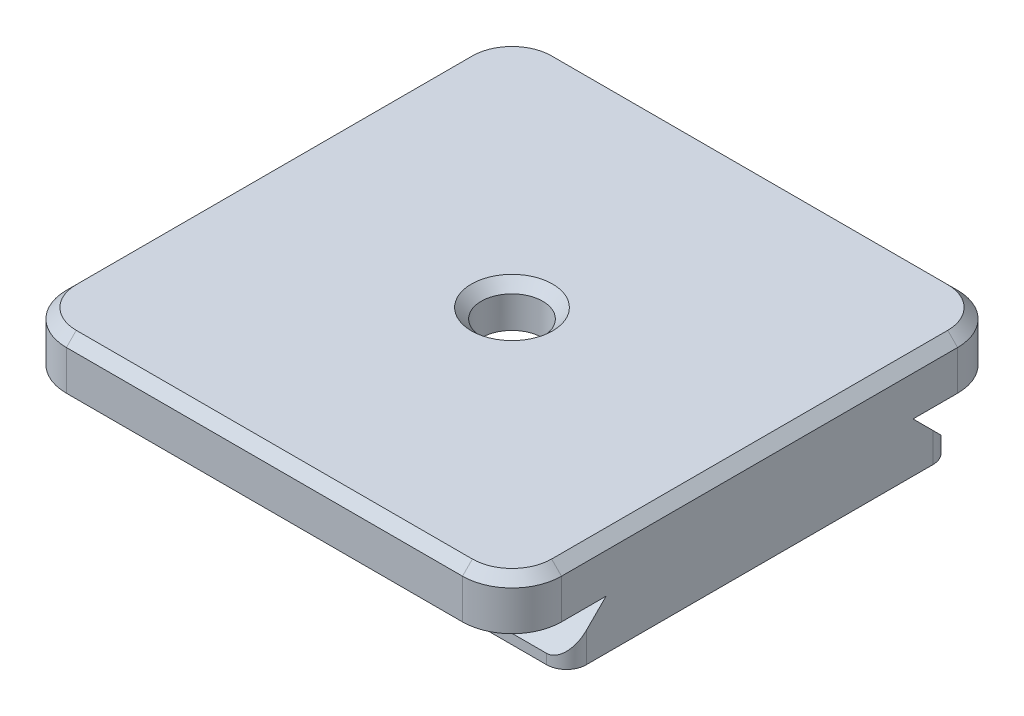
from build123d import *

# Parameters (mm, degrees)
SKETCH1_W           = 50
SKETCH1_H           = 50
BOSS_EXTRUDE1_DEPTH = 10
CUT_EXTRUDE3_DEPTH  = 6.3
SKETCH5_R           = 6.5
SKETCH5_R_2         = 3.1
BOSS_EXTRUDE2_DEPTH = 0.5
SKETCH6_R           = 2.7
BOSS_EXTRUDE3_DEPTH = 2.5
FILLET1_R           = 0.5
CUT_EXTRUDE4_DEPTH  = 57.789083458
FILLET2_R           = 5
CHAMFER1_SIZE       = 1
CHAMFER2_SIZE       = 1
CHAMFER2_SIZE2      = 1.414213562
FILLET3_R           = 2
SKETCH9_R           = 3.1
CUT_EXTRUDE5_DEPTH  = 37.434050008
CHAMFER3_SIZE       = 1


with BuildPart() as part:
    # Sketch1 → Boss-Extrude1 (new body)
    with BuildSketch(Plane(origin=(0, 0, 0), x_dir=(1, 0, 0), z_dir=(0, 1, 0))):
        Rectangle(SKETCH1_W, SKETCH1_H)
    extrude(amount=BOSS_EXTRUDE1_DEPTH)

    # Sketch4 → Cut-Extrude3 (cut)
    with BuildSketch(Plane(origin=(0, 0, 0), x_dir=(-1, 0, 0), z_dir=(0, -1, 0))):
        with BuildLine():
            Line((21, -7.228416147), (21, -10.5))
            ThreePointArc((21, -10.5), (20.267766953, -12.267766953), (18.5, -13))
            Line((18.5, -13), (-18.5, -13))
            ThreePointArc((-18.5, -13), (-20.267766953, -12.267766953), (-21, -10.5))
            Line((-21, -10.5), (-21, -7.228416147))
            ThreePointArc((-21, -7.228416147), (-20.591644852, -6.017356006), (-19.533333333, -5.300838508))
            ThreePointArc((-19.533333333, -5.300838508), (-15.5, 0), (-19.533333333, 5.300838508))
            ThreePointArc((-19.533333333, 5.300838508), (-20.591644852, 6.017356006), (-21, 7.228416147))
            Line((-21, 7.228416147), (-21, 10.5))
            ThreePointArc((-21, 10.5), (-20.267766953, 12.267766953), (-18.5, 13))
            Line((-18.5, 13), (18.5, 13))
            ThreePointArc((18.5, 13), (20.267766953, 12.267766953), (21, 10.5))
            Line((21, 10.5), (21, 7.228416147))
            ThreePointArc((21, 7.228416147), (20.591644852, 6.017356006), (19.533333333, 5.300838508))
            ThreePointArc((19.533333333, 5.300838508), (15.5, 0), (19.533333333, -5.300838508))
            ThreePointArc((19.533333333, -5.300838508), (20.591644852, -6.017356006), (21, -7.228416147))
        make_face()
    extrude(amount=-CUT_EXTRUDE3_DEPTH, mode=Mode.SUBTRACT)

    # Sketch5 → Boss-Extrude2 (add)
    with BuildSketch(Plane(origin=(0, 6.3, 0), x_dir=(-1, 0, 0), z_dir=(0, -1, 0))):
        with Locations(Location((0, 0, 0), (0, 0, 90))):
            Circle(SKETCH5_R)
        with Locations(Location((0, 0, 0), (0, 0, 90))):
            Circle(SKETCH5_R_2, mode=Mode.SUBTRACT)
    extrude(amount=BOSS_EXTRUDE2_DEPTH)

    # Sketch6 → Boss-Extrude3 (add)
    with BuildSketch(Plane.XZ):
        with Locations(Location((-20, 0, 0), (0, 0, 90))):
            Circle(SKETCH6_R)
        with Locations(Location((20, 0, 0), (0, 0, 90))):
            Circle(SKETCH6_R)
    extrude(amount=BOSS_EXTRUDE3_DEPTH)

    # Fillet1
    fillet1_edges = [part.edges().sort_by_distance(p)[0] for p in [
        (-20, -2.5, -2.7),
        (20, -2.5, -2.7),
    ]]
    fillet(fillet1_edges, radius=FILLET1_R)

    # Sketch8 → Cut-Extrude4 (cut, through all)
    with BuildSketch(Plane(origin=(25, 0, 0), x_dir=(0, 0, -1), z_dir=(1, 0, 0))):
        Polygon((-25, 0), (-25, 5), (-15.5, 5), (-20.5, 0), align=None)
        Polygon((25, 0), (25, 5), (15.5, 5), (20.5, 0), align=None)
    extrude(amount=-CUT_EXTRUDE4_DEPTH, mode=Mode.SUBTRACT)

    # Fillet2
    fillet2_edges = [part.edges().sort_by_distance(p)[0] for p in [
        (-25, 7.5, -25),
        (25, 7.5, -25),
        (25, 7.5, 25),
        (-25, 7.5, 25),
    ]]
    fillet(fillet2_edges, radius=FILLET2_R)

    # Chamfer1
    chamfer1_edges = [part.edges().sort_by_distance(p)[0] for p in [
        (0, 10, -25),
        (25, 10, 0),
        (-25, 10, 0),
        (0, 10, 25),
        (23.535533906, 10, 23.535533906),
        (-23.535533906, 10, 23.535533906),
        (-23.535533906, 10, -23.535533906),
        (23.535533906, 10, -23.535533906),
    ]]
    chamfer(chamfer1_edges, length=CHAMFER1_SIZE)

    # Chamfer2
    chamfer2_edges = [part.edges().sort_by_distance(p)[0] for p in [
        (0, 0, 20.5),
        (0, 0, -20.5),
    ]]
    chamfer2_side = [part.faces().sort_by_distance(p)[0] for p in [
        (24.353393474, 0, 0),
    ]]
    chamfer(chamfer2_edges, length=CHAMFER2_SIZE, length2=CHAMFER2_SIZE2, reference=chamfer2_side[0])

    # Fillet3
    fillet3_edges = [part.edges().sort_by_distance(p)[0] for p in [
        (25, 0.5, -19.5),
        (25, 0.5, 19.5),
        (-25, 0.5, -19.5),
        (-25, 0.5, 19.5),
    ]]
    fillet(fillet3_edges, radius=FILLET3_R)

    # Sketch9 → Cut-Extrude5 (cut, through all)
    with BuildSketch(Plane(origin=(0, 6.3, 0), x_dir=(-1, 0, 0), z_dir=(0, -1, 0))):
        with Locations(Location((0, 0, 0), (0, 0, 90))):
            Circle(SKETCH9_R)
    extrude(amount=-CUT_EXTRUDE5_DEPTH, mode=Mode.SUBTRACT)

    # Chamfer3
    chamfer3_edges = [part.edges().sort_by_distance(p)[0] for p in [
        (0, 10, 3.1),
    ]]
    chamfer(chamfer3_edges, length=CHAMFER3_SIZE)


solid = part.part
